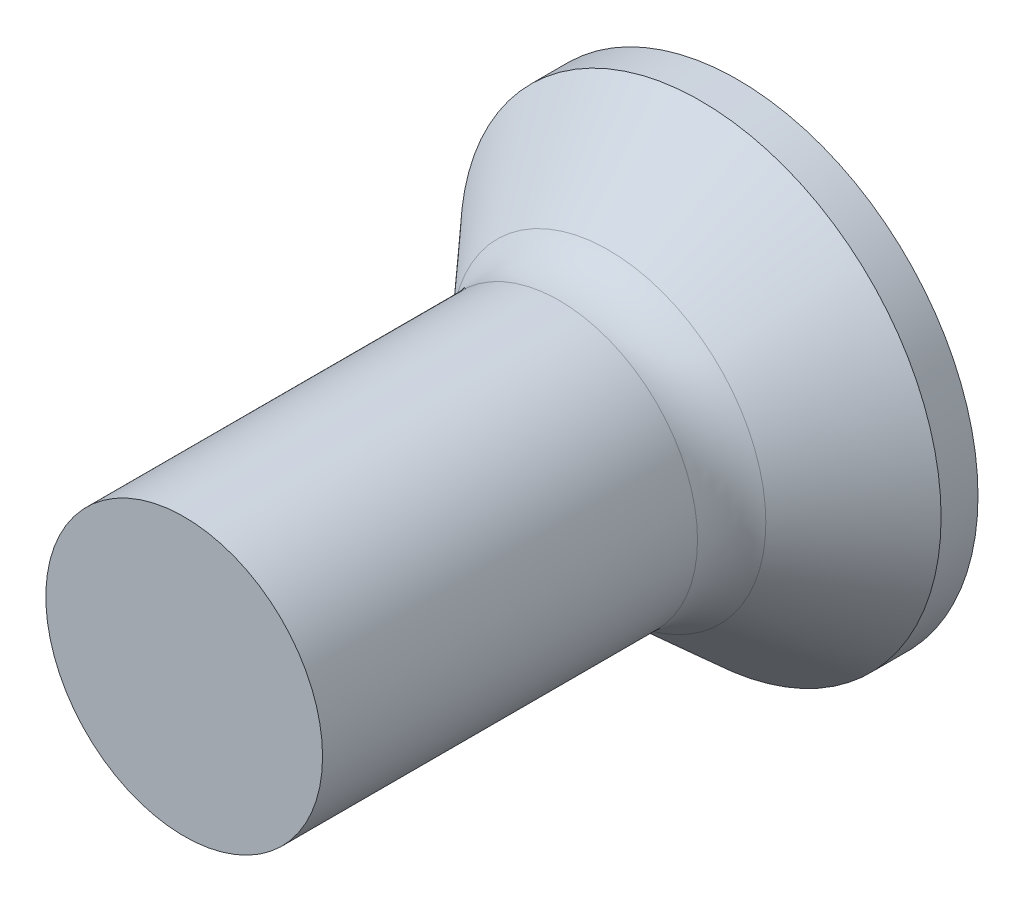
from build123d import *

# Parameters (mm, degrees)
CUT_EXTRUDE_1_DEPTH      = 0.35
PATTERN_CIRCULAR_1_COUNT = 4


with BuildPart() as part:
    # Эскиз1 → Повернуть1 (revolve)
    with BuildSketch(Plane(origin=(0, 0, 0), x_dir=(0, 0, -1), z_dir=(1, 0, 0))):
        with BuildLine():
            Line((-3, 0), (3, 0))
            Line((3, 0), (3, 2.605364683))
            Line((3, 2.605364683), (2.6, 2.605364683))
            Line((2.6, 2.605364683), (1.6, 1.705364683))
            ThreePointArc((1.6, 1.705364683), (1.351439228, 1.553103671), (1.064828215, 1.5))
            Line((1.064828215, 1.5), (-3, 1.5))
            Line((-3, 1.5), (-3, 0))
        make_face()
    revolve(axis=Axis((0, 0, -3), (0, 0, -1)))

    # Эскиз2 → Вырез-Вытянуть1 (cut, symmetric)
    with BuildSketch(Plane(origin=(0, 0, 0), x_dir=(0, 0, -1), z_dir=(1, 0, 0))):
        Polygon((3, 0), (3, 1.497163216), (1, 0.5), (1, 0), align=None)
    cut_extrude_1 = extrude(amount=CUT_EXTRUDE_1_DEPTH, both=True, mode=Mode.SUBTRACT)

    # Круговой массив1: Вырез-Вытянуть1 ×4 about axis
    pattern_circular_1_axis = Axis((0, 0, -3), (0, 0, 1))
    for i in range(1, PATTERN_CIRCULAR_1_COUNT):
        add(cut_extrude_1.rotate(pattern_circular_1_axis, i * 360 / PATTERN_CIRCULAR_1_COUNT), mode=Mode.SUBTRACT)

    # Эскиз3 → Вырез-Повернуть1 (revolve, cut)
    with BuildSketch(Plane(origin=(0, 0, 0), x_dir=(0, 0, -1), z_dir=(1, 0, 0))):
        Polygon((0.8, 0), (0.978705833, 0.55), (3, 0.55), (3, 0), align=None)
    revolve(axis=Axis((0, 0, 0), (0, 0, -1)), mode=Mode.SUBTRACT)


solid = part.part
